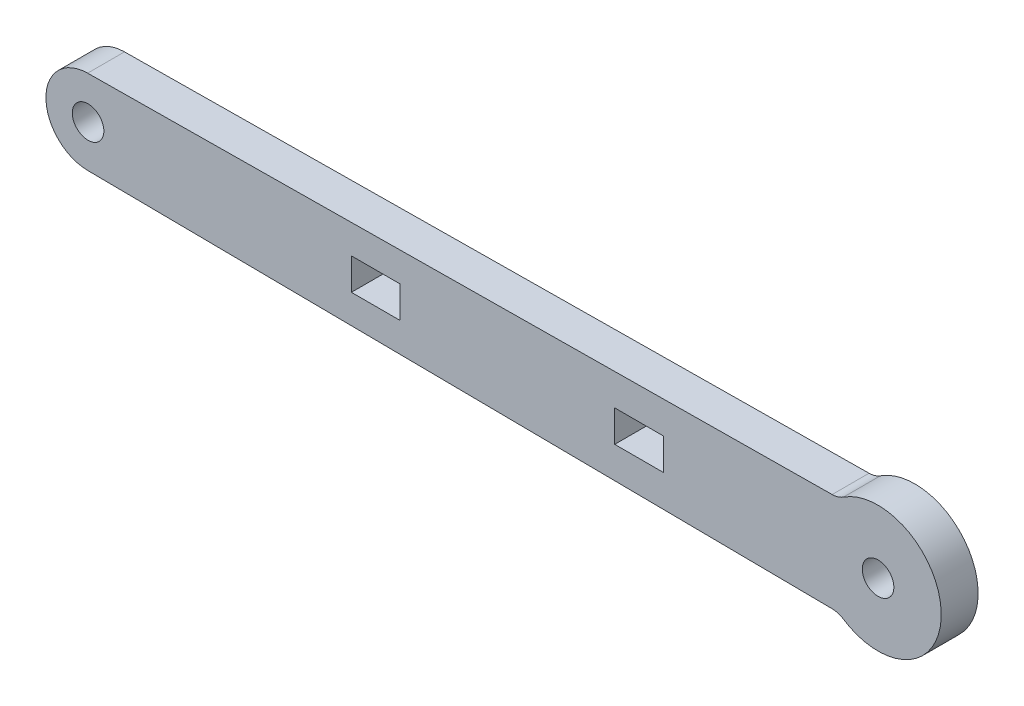
from build123d import *

# Parameters (mm, degrees)
SKETCH1_R           = 1.5
SKETCH1_W           = 4.635083662
SKETCH1_H           = 3
BOSS_EXTRUDE1_DEPTH = 3.5
FILLET1_R           = 2


with BuildPart() as part:
    # Sketch1 → Boss-Extrude1 (new body)
    with BuildSketch(Plane.XY):
        with BuildLine():
            Line((-75.039443802, 3.999805519), (-3.725751189, 4.703060501))
            ThreePointArc((-3.725751189, 4.703060501), (6, 0), (-3.725751189, -4.703060501))
            Line((-3.725751189, -4.703060501), (-75.039443802, -3.999805519))
            ThreePointArc((-75.039443802, -3.999805519), (-79, 0), (-75.039443802, 3.999805519))
        make_face()
        with Locations((-75, 0)):
            Circle(SKETCH1_R, mode=Mode.SUBTRACT)
        Circle(SKETCH1_R, mode=Mode.SUBTRACT)
        with Locations((-47.682458169, 0)):
            Rectangle(SKETCH1_W, SKETCH1_H, mode=Mode.SUBTRACT)
        with Locations((-22.682458169, 0)):
            Rectangle(SKETCH1_W, SKETCH1_H, mode=Mode.SUBTRACT)
    extrude(amount=BOSS_EXTRUDE1_DEPTH)

    # Fillet1
    fillet1_edges = [part.edges().sort_by_distance(p)[0] for p in [
        (-3.725751189, 4.703060501, 1.75),
        (-3.725751189, -4.703060501, 1.75),
    ]]
    fillet(fillet1_edges, radius=FILLET1_R)


solid = part.part
